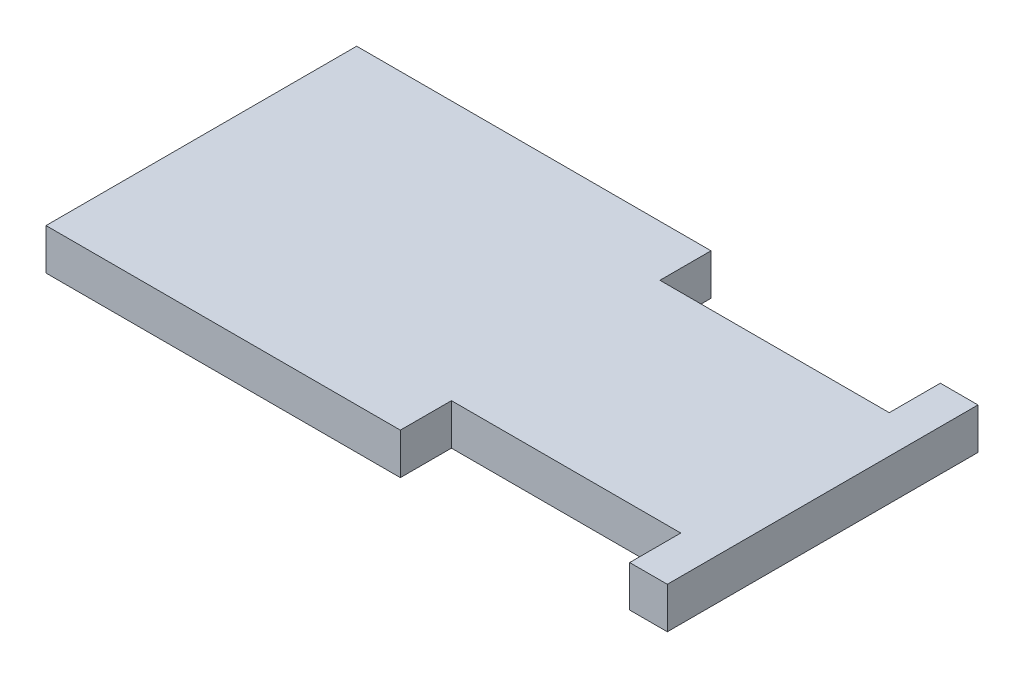
from build123d import *

# Parameters (mm, degrees)
SKETCH1_W               = 203.2
SKETCH1_H               = 101.6
BOSS_EXTRUDE2_DEPTH     = 13.462
CUT_EXTRUDE1_DEPTH      = 13.208
CUT_EXTRUDE1_DEPTH_BACK = 28.448
SKETCH4_W               = 75
SKETCH4_H               = 23.376263875
SKETCH5_R               = 16.179381977
BOSS_EXTRUDE4_DEPTH     = 1.524
SKETCH6_R               = 8.05355352
BOSS_EXTRUDE6_DEPTH     = 11.43


with BuildPart() as part:
    # Sketch1 → Boss-Extrude2 (new body)
    with BuildSketch(Plane(origin=(0, 0, 0), x_dir=(1, 0, 0), z_dir=(0, 1, 0))):
        Rectangle(SKETCH1_W, SKETCH1_H)
    extrude(amount=BOSS_EXTRUDE2_DEPTH)

    # Sketch4 → Cut-Extrude1 (cut, two sides: drawn at the far end of the back side and taken through both)
    with BuildSketch(Plane(origin=(0, 13.462, 0), x_dir=(1, 0, 0), z_dir=(0, 1, 0)).offset(-CUT_EXTRUDE1_DEPTH_BACK)):
        with Locations((51.78549459, -45.778516755)):
            Rectangle(SKETCH4_W, SKETCH4_H)
        with Locations((51.78549459, 45.778516755)):
            Rectangle(SKETCH4_W, SKETCH4_H)
    extrude(amount=CUT_EXTRUDE1_DEPTH + CUT_EXTRUDE1_DEPTH_BACK, mode=Mode.SUBTRACT)

    # Sketch5 → Boss-Extrude4 (add)
    with BuildSketch(Plane(origin=(0, 0, 0), x_dir=(-1, 0, 0), z_dir=(0, -1, 0))):
        with Locations(Location((81.651405353, 0, 0), (0, 0, 270))):
            Circle(SKETCH5_R)
    extrude(amount=BOSS_EXTRUDE4_DEPTH)

    # Sketch6 → Boss-Extrude6 (add)
    with BuildSketch(Plane.XZ.offset(1.524)):
        with Locations(Location((-81.651405353, 0, 0), (0, 0, 270))):
            Circle(SKETCH6_R)
    extrude(amount=BOSS_EXTRUDE6_DEPTH)

    # Sketch7 → Revolve1 (revolve)
    with BuildSketch(Plane.XZ.offset(12.954)):
        with BuildLine():
            Line((-86.486836617, 0), (-76.815974088, 0))
            ThreePointArc((-76.815974088, 0), (-81.651405353, 4.835431264), (-86.486836617, 0))
        make_face()
    revolve(axis=Axis((-86.486836617, -12.954, 0), (1, 0, 0)))


solid = part.part
